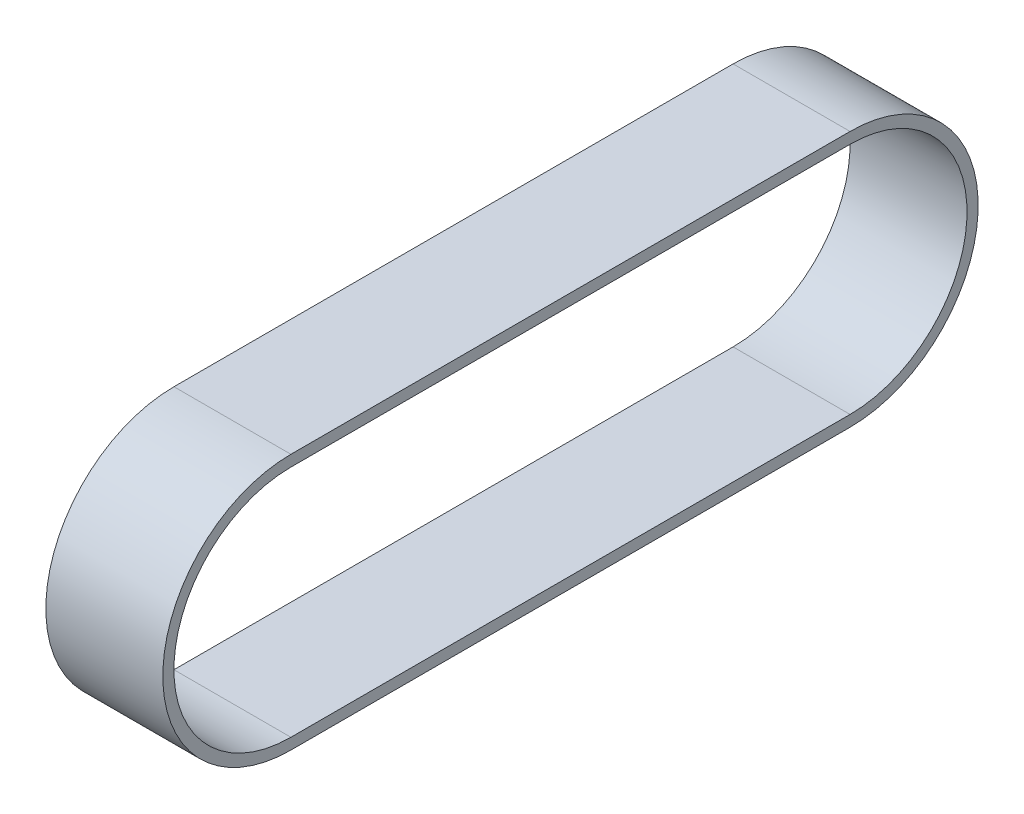
from build123d import *

# Parameters (mm, degrees)
EXTRUDE_1_DEPTH = 50


with BuildPart() as part:
    # 스케치1 → 보스-돌출1 (new body)
    with BuildSketch(Plane(origin=(0, 0, 0), x_dir=(0, 0, -1), z_dir=(1, 0, 0))):
        with BuildLine():
            Line((-41.946043138, 54.752), (197.053956862, 54.752))
            ThreePointArc((197.053956862, 54.752), (251.805956862, 0), (197.053956862, -54.752))
            Line((197.053956862, -54.752), (-41.946043138, -54.752))
            ThreePointArc((-41.946043138, -54.752), (-96.698043138, 0), (-41.946043138, 54.752))
        make_face()
        with BuildLine():
            Line((-41.946043138, 50), (197.053956862, 50))
            ThreePointArc((197.053956862, 50), (247.053956862, 0), (197.053956862, -50))
            Line((197.053956862, -50), (-41.946043138, -50))
            ThreePointArc((-41.946043138, -50), (-91.946043138, 0), (-41.946043138, 50))
        make_face(mode=Mode.SUBTRACT)
    extrude(amount=EXTRUDE_1_DEPTH)


solid = part.part
